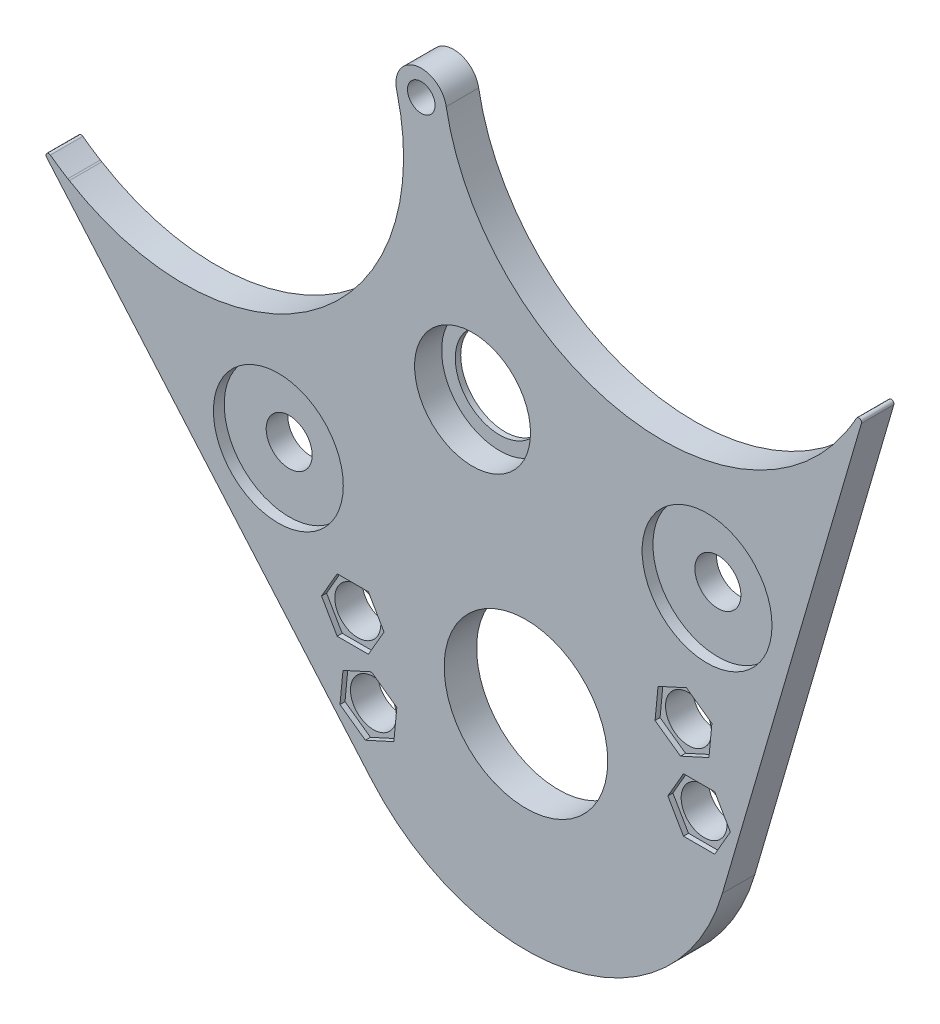
from build123d import *

# Parameters (mm, degrees)
SKETCH1_R                        = 12.000000003
SKETCH1_R_2                      = 8.500000018
BOSS_EXTRUDE1_DEPTH              = 4.7625
SKETCH1_4_R                      = 9.525
CUT_EXTRUDE1_DEPTH               = 1.5875
F_10_32_TAPPED_HOLE1_D           = 4.0386
BOSS_EXTRUDE3_START              = -0.79375
SKETCH7_R                        = 8.500000018
SKETCH7_R_2                      = 6.5
BOSS_EXTRUDE3_DEPTH              = 0.79375
F_17_64_0_26563_DIAMETER_HOLE1_D = 6.747002
CUT_EXTRUDE2_DEPTH               = 0.7366


with BuildPart() as part:
    # Sketch1 → Boss-Extrude1 (new body)
    with BuildSketch(Plane.XY):
        with BuildLine():
            Line((-70.300649756, 35.543758941), (-22.715793489, -19.601472909))
            ThreePointArc((-22.715793489, -19.601472909), (6.372007721, -29.319320109), (28.80246523, -8.404939663))
            Line((28.80246523, -8.404939663), (49.20643424, 61.516396068))
            ThreePointArc((49.20643424, 61.516396068), (48.977980792, 61.993965606), (48.478121662, 61.819596767))
            ThreePointArc((48.478121662, 61.819596767), (47.697638407, 60.484610946), (46.853975269, 59.18862724))
            ThreePointArc((46.853975269, 59.18862724), (46.782773661, 59.083463588), (46.711157924, 58.978581516))
            ThreePointArc((46.711157924, 58.978581516), (13.35804262, 45.469068231), (-11.695774538, 71.300125033))
            ThreePointArc((-11.695774538, 71.300125033), (-16.142405131, 74.275551921), (-18.952954781, 69.722915382))
            ThreePointArc((-18.952954781, 69.722915382), (-31.025391021, 35.82315688), (-66.977119299, 34.270553581))
            ThreePointArc((-66.977119299, 34.270553581), (-67.0858071, 34.336250039), (-67.194235, 34.402374566))
            ThreePointArc((-67.194235, 34.402374566), (-68.499704148, 35.231284429), (-69.763880718, 36.121901549))
            ThreePointArc((-69.763880718, 36.121901549), (-70.291023197, 36.073070731), (-70.300649756, 35.543758941))
        make_face()
        Circle(SKETCH1_R, mode=Mode.SUBTRACT)
        with Locations((-7.832512348, 36.039494433)):
            Circle(SKETCH1_R_2, mode=Mode.SUBTRACT)
    extrude(amount=-BOSS_EXTRUDE1_DEPTH)

    # Sketch1<4> → Cut-Extrude1 (cut)
    with BuildSketch(Plane.XY):
        with Locations((-36.319050549, 15.602840887)):
            Circle(SKETCH1_4_R)
        with Locations((26.566795152, 29.269907275)):
            Circle(SKETCH1_4_R)
    extrude(amount=-CUT_EXTRUDE1_DEPTH, mode=Mode.SUBTRACT)

    # #10-32 Tapped Hole1 (through all)
    with Locations(Plane.XY):
        with Locations((-15.353270713, 70.644524994)):
            Hole(F_10_32_TAPPED_HOLE1_D / 2)

    # Sketch7 → Boss-Extrude3 (add)
    with BuildSketch(Plane(origin=(0, 0, -4.7625), x_dir=(-1, 0, 0), z_dir=(0, 0, -1)).offset(BOSS_EXTRUDE3_START)):
        with Locations((7.832512348, 36.039494433)):
            Circle(SKETCH7_R)
        with Locations((7.832512348, 36.039494433)):
            Circle(SKETCH7_R_2, mode=Mode.SUBTRACT)
    extrude(amount=BOSS_EXTRUDE3_DEPTH)

    # 17/64 (0.26563) Diameter Hole1 (through all)
    with Locations(Plane.XY):
        with Locations((-36.319050549, 15.602840887), (26.566795152, 29.269907275), (23.108788276, 10.542480941), (25.4, 0), (-23.108788276, -10.542480941), (-25.4, 0)):
            Hole(F_17_64_0_26563_DIAMETER_HOLE1_D / 2)

    # Sketch1<5> → Cut-Extrude2 (cut)
    with BuildSketch(Plane.XY):
        Polygon((-27.691358881, 3.96875), (-29.982717762, 0), (-27.691358881, -3.96875), (-23.108641119, -3.96875), (-20.817282238, 0), (-23.108641119, 3.96875), align=None)
        Polygon((-19.376859203, -13.202181577), (-18.939455423, -8.640385876), (-22.671384497, -5.98068524), (-26.84071735, -7.882780306), (-27.27812113, -12.444576006), (-23.546192056, -15.104276642), align=None)
        Polygon((19.376859203, 13.202181577), (18.939455423, 8.640385876), (22.671384497, 5.98068524), (26.84071735, 7.882780306), (27.27812113, 12.444576006), (23.546192056, 15.104276642), align=None)
        Polygon((23.108641119, 3.96875), (20.817282238, 0), (23.108641119, -3.96875), (27.691358881, -3.96875), (29.982717762, 0), (27.691358881, 3.96875), align=None)
    extrude(amount=-CUT_EXTRUDE2_DEPTH, mode=Mode.SUBTRACT)


solid = part.part
